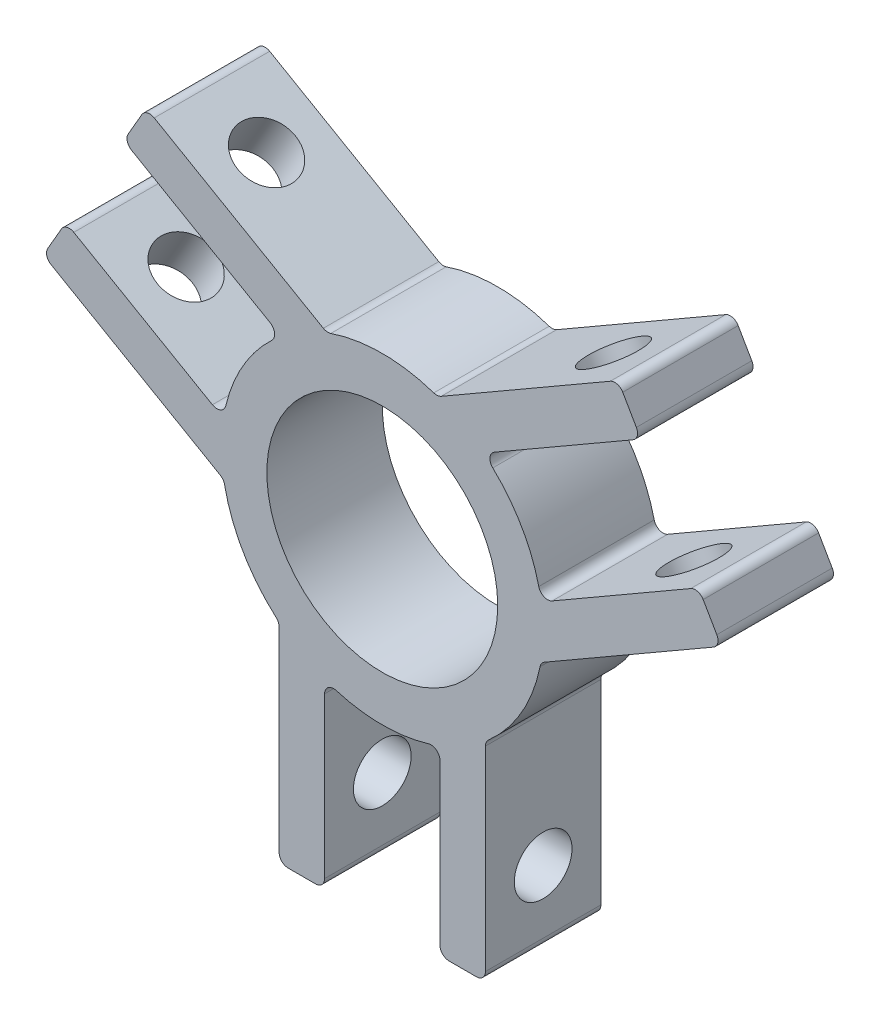
from build123d import *

# Parameters (mm, degrees)
ESQUISSE1_R             = 17.7
ESQUISSE1_R_2           = 12.7
BOSS_EXTRU_1_DEPTH      = 12.7
BOSS_EXTRU_2_DEPTH      = 12.7
ESQUISSE3_R             = 3.175
ENL_V_MAT_EXTRU_1_DEPTH = 65.473936294
ESQUISSE4_R             = 3.175
ENL_V_MAT_EXTRU_2_DEPTH = 65.473936294
ESQUISSE5_R             = 3.175
ENL_V_MAT_EXTRU_3_DEPTH = 63.147513732
CONG_1_R                = 1


with BuildPart() as part:
    # Esquisse1 → Boss.-Extru.1 (new body)
    with BuildSketch(Plane.XY):
        Circle(ESQUISSE1_R)
        Circle(ESQUISSE1_R_2, mode=Mode.SUBTRACT)
    extrude(amount=BOSS_EXTRU_1_DEPTH)

    # Esquisse2 → Boss.-Extru.2 (add)
    with BuildSketch(Plane.XY.offset(12.7)):
        Polygon((28.45374434, 23.760125373), (11.133236264, 13.760125373), (6.087254248, 16.620328989), (25.95374434, 28.090252392), align=None)
        Polygon((17.483236264, 2.761602745), (17.437254248, -3.038447676), (37.30374434, 8.431475726), (34.80374434, 12.761602745), align=None)
        Polygon((11.35, -36.521728118), (11.35, -13.581881313), (6.35, -16.521728118), (6.35, -36.521728118), align=None)
        Polygon((-6.35, -16.521728118), (-11.35, -13.581881313), (-11.35, -36.521728118), (-6.35, -36.521728118), align=None)
        Polygon((-37.30374434, 8.431475726), (-17.437254248, -3.038447676), (-17.483236264, 2.761602745), (-34.80374434, 12.761602745), align=None)
        Polygon((-11.133236264, 13.760125373), (-6.087254248, 16.620328989), (-25.95374434, 28.090252392), (-28.45374434, 23.760125373), align=None)
    extrude(amount=-BOSS_EXTRU_2_DEPTH)

    # Esquisse3 → Enlèv. mat.-Extru.1 (cut, through all)
    with BuildSketch(Plane(origin=(5.675, 9.829388333, 0), x_dir=(0.8660254037845352, -0.49999999999983297, 0), z_dir=(0.4999999999998329, 0.8660254037845351, 0))):
        with Locations(Location((-28.584228118, -6.35, 0), (0, 0, 180))):
            Circle(ESQUISSE3_R)
    extrude(amount=-ENL_V_MAT_EXTRU_1_DEPTH, mode=Mode.SUBTRACT)

    # Esquisse4 → Enlèv. mat.-Extru.2 (cut, through all)
    with BuildSketch(Plane(origin=(-5.675, 9.829388333, 0), x_dir=(0.8660254037844395, 0.4999999999999985, 0), z_dir=(-0.4999999999999985, 0.8660254037844395, 0))):
        with Locations(Location((28.584228118, -6.35, 0), (0, 0, 180))):
            Circle(ESQUISSE4_R)
    extrude(amount=-ENL_V_MAT_EXTRU_2_DEPTH, mode=Mode.SUBTRACT)

    # Esquisse5 → Enlèv. mat.-Extru.3 (cut, through all)
    with BuildSketch(Plane(origin=(11.35, 0, 0), x_dir=(0, 0, -1), z_dir=(1, 0, 0))):
        with Locations(Location((-6.35, -28.584228118, 0), (0, 0, 90))):
            Circle(ESQUISSE5_R)
    extrude(amount=-ENL_V_MAT_EXTRU_3_DEPTH, mode=Mode.SUBTRACT)

    # Congé1
    cong_1_edges = [part.edges().sort_by_distance(p)[0] for p in [
        (25.95374434, 28.090252392, 6.35),
        (28.45374434, 23.760125373, 6.35),
        (11.133236264, 13.760125373, 6.35),
        (6.087254248, 16.620328989, 6.35),
        (17.483236264, 2.761602745, 6.35),
        (34.80374434, 12.761602745, 6.35),
        (37.30374434, 8.431475726, 6.35),
        (17.437254248, -3.038447676, 6.35),
        (11.35, -36.521728118, 6.35),
        (6.35, -36.521728118, 6.35),
        (6.35, -16.521728118, 6.35),
        (11.35, -13.581881313, 6.35),
        (-6.35, -16.521728118, 6.35),
        (-6.35, -36.521728118, 6.35),
        (-11.35, -36.521728118, 6.35),
        (-11.35, -13.581881313, 6.35),
        (-37.30374434, 8.431475726, 6.35),
        (-34.80374434, 12.761602745, 6.35),
        (-17.483236264, 2.761602745, 6.35),
        (-17.437254248, -3.038447676, 6.35),
        (-11.133236264, 13.760125373, 6.35),
        (-28.45374434, 23.760125373, 6.35),
        (-25.95374434, 28.090252392, 6.35),
        (-6.087254248, 16.620328989, 6.35),
    ]]
    fillet(cong_1_edges, radius=CONG_1_R)


solid = part.part
